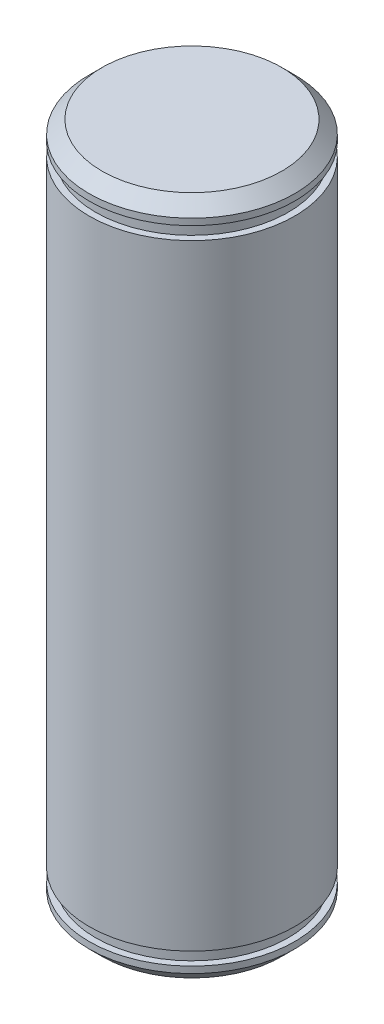
from build123d import *

# Parameters (mm, degrees)
SKETCH1_R           = 15.875
BOSS_EXTRUDE1_DEPTH = 105
CHAMFER1_SIZE       = 2
CUT_EXTRUDE1_START  = 3
SKETCH1_3_R         = 15.875
SKETCH1_3_R_2       = 14.875
CUT_EXTRUDE1_DEPTH  = 2


with BuildPart() as part:
    # Sketch1 → Boss-Extrude1 (new body)
    with BuildSketch(Plane(origin=(0, 0, 0), x_dir=(1, 0, 0), z_dir=(0, 1, 0))):
        Circle(SKETCH1_R)
    extrude(amount=BOSS_EXTRUDE1_DEPTH)

    # Chamfer1
    chamfer1_edges = [part.edges().sort_by_distance(p)[0] for p in [
        (-15.875, 0, 0),
        (-15.875, 105, 0),
    ]]
    chamfer(chamfer1_edges, length=CHAMFER1_SIZE)

    # Sketch1<3> → Cut-Extrude1 (cut)
    with BuildSketch(Plane(origin=(0, 0, 0), x_dir=(1, 0, 0), z_dir=(0, 1, 0)).offset(CUT_EXTRUDE1_START)):
        Circle(SKETCH1_3_R)
        Circle(SKETCH1_3_R_2, mode=Mode.SUBTRACT)
    cut_extrude1 = extrude(amount=CUT_EXTRUDE1_DEPTH, mode=Mode.SUBTRACT)

    # Mirror1: Cut-Extrude1 across plane
    add(cut_extrude1.mirror(Plane(origin=(0, 52.5, 0), x_dir=(0, 0, 1), z_dir=(0, -1, 0))), mode=Mode.SUBTRACT)


solid = part.part
